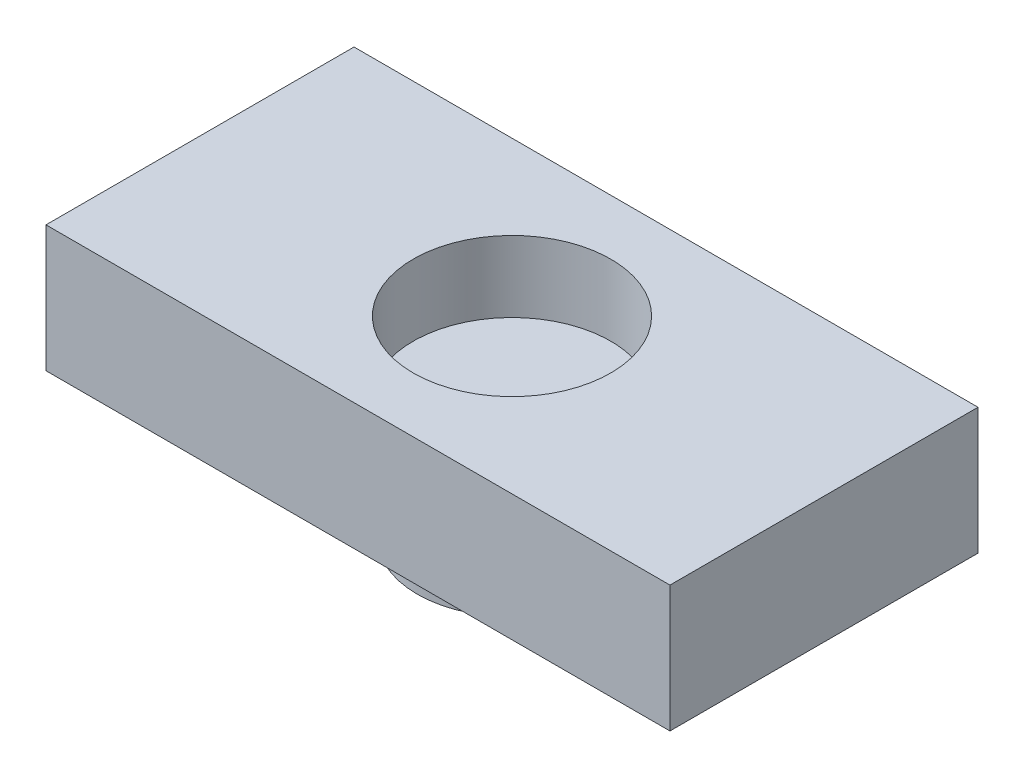
from build123d import *

# Parameters (mm, degrees)
SKETCH_1_W          = 15.8
SKETCH_1_H          = 7.8
SKETCH_1_R          = 2.4
EXTRUDE_1_DEPTH     = 3.2
SKETCH_2_R          = 2.4
SKETCH_2_R_2        = 1.6
EXTRUDE_2_DEPTH     = 1.7
SKETCH_3_R          = 2.5
CUT_EXTRUDE_1_DEPTH = 1.8


with BuildPart() as part:
    # Эскиз1 → Бобышка-Вытянуть1 (new body)
    # profile 1 of 2: a face of its own
    with BuildSketch(Plane(origin=(0, 0, 0), x_dir=(1, 0, 0), z_dir=(0, 1, 0))):
        Rectangle(SKETCH_1_W, SKETCH_1_H)
        Circle(SKETCH_1_R, mode=Mode.SUBTRACT)
    # profile 2 of 2: a face of its own
    with BuildSketch(Plane(origin=(0, 0, 0), x_dir=(1, 0, 0), z_dir=(0, 1, 0))):
        Circle(SKETCH_1_R)
    extrude(amount=EXTRUDE_1_DEPTH)

    # Эскиз2 → Бобышка-Вытянуть2 (add)
    with BuildSketch(Plane(origin=(0, 0, 0), x_dir=(1, 0, 0), z_dir=(0, 1, 0))):
        with Locations(Location((0, 0, 0), (0, 0, 270))):
            Circle(SKETCH_2_R)
        with Locations(Location((0, 0, 0), (0, 0, 270))):
            Circle(SKETCH_2_R_2, mode=Mode.SUBTRACT)
    extrude(amount=-EXTRUDE_2_DEPTH)

    # Эскиз3 → Вырез-Вытянуть1 (cut)
    with BuildSketch(Plane(origin=(0, 3.2, 0), x_dir=(1, 0, 0), z_dir=(0, 1, 0))):
        with Locations(Location((0, 0, 0), (0, 0, 270))):
            Circle(SKETCH_3_R)
    extrude(amount=-CUT_EXTRUDE_1_DEPTH, mode=Mode.SUBTRACT)


solid = part.part
